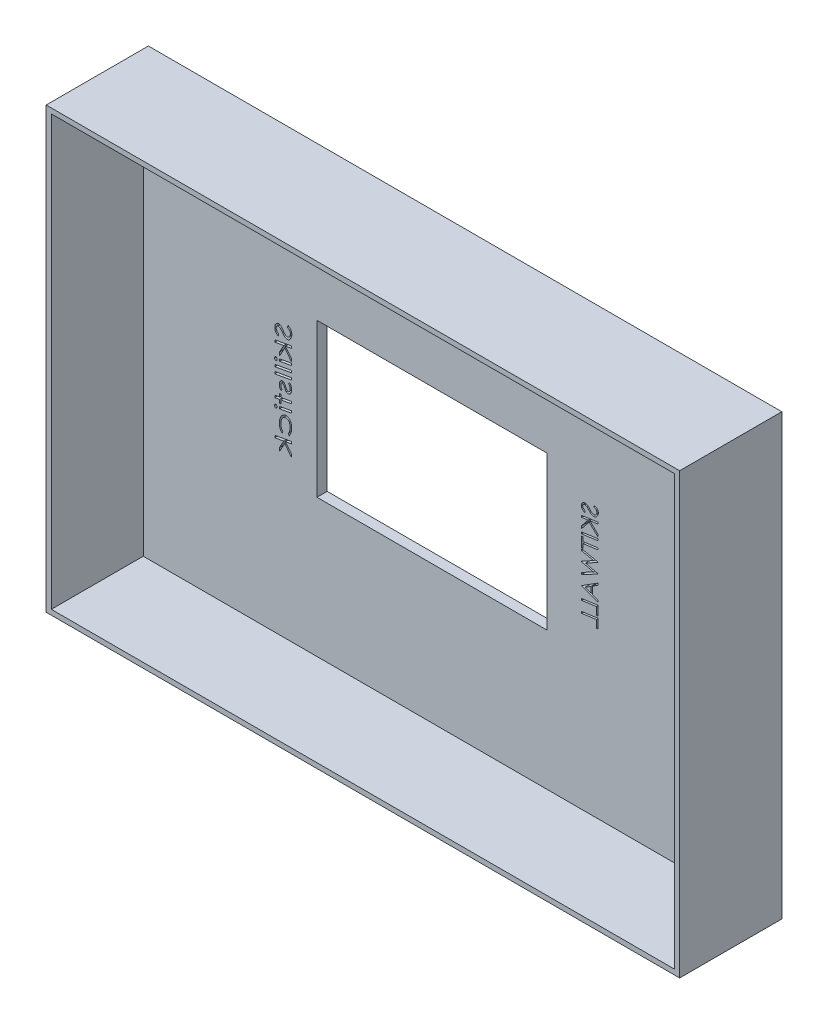
from build123d import *

# Parameters (mm, degrees)
SKETCH1_W           = 124
SKETCH1_H           = 86
BOSS_EXTRUDE1_DEPTH = 20
SKETCH2_W           = 122
SKETCH2_H           = 84
CUT_EXTRUDE1_DEPTH  = 18
SKETCH3_W           = 45
SKETCH3_H           = 30
CUT_EXTRUDE3_DEPTH  = 2


with BuildPart() as part:
    # Sketch1 → Boss-Extrude1 (new body)
    with BuildSketch(Plane.XY):
        with Locations((10.680291971, -5.981021898)):
            Rectangle(SKETCH1_W, SKETCH1_H)
    extrude(amount=BOSS_EXTRUDE1_DEPTH)

    # Sketch2 → Cut-Extrude1 (cut)
    with BuildSketch(Plane.XY.offset(20)):
        with Locations((10.680291971, -5.981021898)):
            Rectangle(SKETCH2_W, SKETCH2_H)
    extrude(amount=-CUT_EXTRUDE1_DEPTH, mode=Mode.SUBTRACT)

    # Sketch3 → Cut-Extrude3 (cut)
    # profile 1 of 21: a face of its own
    with BuildSketch(Plane(origin=(0, 0, 0), x_dir=(-1, 0, 0), z_dir=(0, 0, -1))):
        with Locations((-6.180291971, -5.981021898)):
            Rectangle(SKETCH3_W, SKETCH3_H)
    # profile 2 of 21: a face of its own
    with BuildSketch(Plane(origin=(0, 0, 0), x_dir=(-1, 0, 0), z_dir=(0, 0, -1))):
        with BuildLine():
            Line((23.87777093, 2.582439641), (23.80272085, 2.990762958))
            add(Edge.make_bspline(
                [(23.80272085, 2.990762958), (23.83890379, 3.006202168), (23.910195381, 3.036622191), (24.006391251, 3.10085006), (24.091189179, 3.177917187), (24.161474839, 3.268589162), (24.219582314, 3.366628265), (24.260220965, 3.470914038), (24.286642436, 3.578617158), (24.289660373, 3.652067565), (24.291182388, 3.689110314)],
                knots=[0, 0, 0, 0, 1.040424116, 2.049957518, 3.047859964, 4.063733633, 5.078193139, 6.056602271, 7.019899302, 8, 8, 8, 8], degree=3))
            add(Edge.make_bspline(
                [(24.291182388, 3.689110314), (24.290832534, 3.709476418), (24.29014959, 3.749232613), (24.284354108, 3.807272988), (24.274729855, 3.862527969), (24.26166052, 3.914935872), (24.24441416, 3.964645422), (24.22264099, 4.01083436), (24.197738157, 4.054576539), (24.169266186, 4.095090979), (24.137725802, 4.131942457), (24.103217167, 4.164060328), (24.06577851, 4.191051187), (24.026022358, 4.213491185), (23.982969811, 4.229848963), (23.9382277, 4.242964831), (23.890272724, 4.24977654), (23.857648487, 4.250815793), (23.840881907, 4.251349897)],
                knots=[0, 0, 0, 0, 1.20849648, 2.359077707, 3.457497078, 4.53474134, 5.561418966, 6.574670319, 7.56100237, 8.545406421, 9.50892298, 10.434902817, 11.335926509, 12.242729982, 13.135279908, 14.063394424, 15.004719994, 16, 16, 16, 16], degree=3))
            add(Edge.make_bspline(
                [(23.840881907, 4.251349897), (23.825804849, 4.250819432), (23.795042851, 4.249737116), (23.748644795, 4.242046), (23.702229675, 4.228225819), (23.655017769, 4.210369351), (23.607848787, 4.186620262), (23.55958276, 4.158526917), (23.511318886, 4.124624241), (23.479894743, 4.099113491), (23.463723454, 4.085985314)],
                knots=[0, 0, 0, 0, 0.861041419, 1.756798584, 2.676539428, 3.623222833, 4.635828562, 5.68868022, 6.810563605, 8, 8, 8, 8], degree=3))
            add(Edge.make_bspline(
                [(23.463723454, 4.085985314), (23.452567703, 4.076161356), (23.427905167, 4.054443076), (23.390497232, 4.015323312), (23.349703676, 3.966696847), (23.303480077, 3.90997717), (23.253661104, 3.843683158), (23.198687556, 3.768749667), (23.140702331, 3.684045194), (23.100528107, 3.624679404), (23.079568806, 3.593707669)],
                knots=[0, 0, 0, 0, 0.569759019, 1.259592684, 2.072497206, 3.003039976, 4.064660121, 5.251552732, 6.566107193, 8, 8, 8, 8], degree=3))
            add(Edge.make_bspline(
                [(23.079568806, 3.593707669), (23.057872833, 3.561176634), (23.015842883, 3.498156747), (22.952209793, 3.407755113), (22.888832888, 3.32572634), (22.827174052, 3.250600521), (22.766057888, 3.184127753), (22.70674892, 3.124127389), (22.648086164, 3.072293525), (22.590175331, 3.027817976), (22.533119629, 2.989923578), (22.476351534, 2.957730239), (22.420531293, 2.929048225), (22.364059562, 2.907133429), (22.308397528, 2.888769809), (22.252670519, 2.877123648), (22.197661986, 2.868796346), (22.160978214, 2.867847787), (22.14271484, 2.867375538)],
                knots=[0, 0, 0, 0, 1.520170293, 2.944909634, 4.296714461, 5.549350901, 6.721961554, 7.80597782, 8.82789845, 9.762604862, 10.642697466, 11.488145661, 12.29906103, 13.079627452, 13.840762024, 14.574725496, 15.290413151, 16, 16, 16, 16], degree=3))
            add(Edge.make_bspline(
                [(22.14271484, 2.867375538), (22.123607309, 2.867834149), (22.085212983, 2.868755674), (22.028070705, 2.877219432), (21.971579215, 2.891572414), (21.915614068, 2.910651359), (21.859948757, 2.934853412), (21.805016744, 2.965160411), (21.750571821, 3.000626902), (21.69705398, 3.041504489), (21.645537243, 3.08688703), (21.596035665, 3.136192558), (21.549902242, 3.189487176), (21.506342409, 3.246750827), (21.465099061, 3.307196984), (21.427571223, 3.372061236), (21.392579618, 3.44021417), (21.349256521, 3.53580709), (21.305471574, 3.660926541), (21.265964725, 3.815715706), (21.242687999, 3.975245367), (21.239768263, 4.083155237), (21.238297773, 4.137502742)],
                knots=[0, 0, 0, 0, 0.668982992, 1.344242259, 2.017825385, 2.708226424, 3.413209583, 4.140977225, 4.903055327, 5.68724377, 6.497576667, 7.306206538, 8.132609876, 8.964334176, 9.825248329, 10.69384638, 11.587230732, 12.507851973, 14.368044277, 16.221301885, 18.096904294, 20, 20, 20, 20], degree=3))
            add(Edge.make_bspline(
                [(21.238297773, 4.137502742), (21.238923359, 4.172081633), (21.24015361, 4.24008301), (21.249410869, 4.340096145), (21.26344618, 4.436758298), (21.285784224, 4.529542827), (21.311881696, 4.61954347), (21.345291494, 4.70550136), (21.384150635, 4.788109463), (21.429245228, 4.866799835), (21.480109777, 4.94137235), (21.536720483, 5.010941544), (21.599300047, 5.074580527), (21.667259854, 5.133044226), (21.740998389, 5.185695101), (21.820356851, 5.232637735), (21.90458474, 5.275458392), (21.964184357, 5.298138321), (21.994522733, 5.30968323)],
                knots=[0, 0, 0, 0, 1.110060354, 2.182997449, 3.222707229, 4.243119384, 5.244579262, 6.229336086, 7.200662002, 8.173298863, 9.138091364, 10.095967355, 11.049042419, 12.00000032, 12.970920677, 13.953864319, 14.958442399, 16, 16, 16, 16], degree=3))
            Line((21.994522733, 5.30968323), (22.093105465, 4.909628142))
            add(Edge.make_bspline(
                [(22.093105465, 4.909628142), (22.0696825, 4.901209862), (22.023751873, 4.884702265), (21.957853959, 4.855739906), (21.897485189, 4.821529285), (21.840798613, 4.784864937), (21.789554598, 4.74319129), (21.742005074, 4.69882827), (21.699882166, 4.650020466), (21.662354668, 4.597785196), (21.629551554, 4.542798141), (21.601182647, 4.48532358), (21.577273716, 4.42597285), (21.557272205, 4.364397717), (21.542143232, 4.300989608), (21.531452593, 4.235299414), (21.523983536, 4.167779909), (21.523484759, 4.121834869), (21.52323367, 4.098705666)],
                knots=[0, 0, 0, 0, 1.119667471, 2.195581549, 3.233144551, 4.238377303, 5.228933006, 6.200479696, 7.160535075, 8.124042796, 9.090755306, 10.037692277, 11.004734089, 11.966919088, 12.94778449, 13.934060519, 14.959984955, 16, 16, 16, 16], degree=3))
            add(Edge.make_bspline(
                [(21.52323367, 4.098705666), (21.523648, 4.072392175), (21.524465429, 4.020478338), (21.533156208, 3.94419747), (21.546219999, 3.870530536), (21.565479309, 3.79999177), (21.589576044, 3.731987241), (21.61979626, 3.66708745), (21.654579498, 3.604444806), (21.69511259, 3.545892308), (21.739194534, 3.492125382), (21.786189954, 3.444400348), (21.836794951, 3.405048952), (21.889290492, 3.372111671), (21.944289508, 3.346273233), (22.002138361, 3.328601224), (22.062354985, 3.317367406), (22.1034439, 3.315883888), (22.124270329, 3.315131948)],
                knots=[0, 0, 0, 0, 1.153147951, 2.275043374, 3.361614631, 4.430348707, 5.476988232, 6.520858919, 7.565391488, 8.614710216, 9.638187901, 10.610899785, 11.544316246, 12.441873011, 13.323454024, 14.199530016, 15.087409336, 16, 16, 16, 16], degree=3))
            add(Edge.make_bspline(
                [(22.124270329, 3.315131948), (22.155391772, 3.316727271), (22.218188853, 3.319946324), (22.310912549, 3.346505322), (22.402235578, 3.38770376), (22.476305621, 3.435724953), (22.535985825, 3.483869686), (22.583843748, 3.528689674), (22.633125947, 3.581908716), (22.685492862, 3.642268794), (22.739250152, 3.711087539), (22.795094188, 3.787693376), (22.85391317, 3.871551097), (22.892357771, 3.931085659), (22.91229617, 3.961961876)],
                knots=[0, 0, 0, 0, 1.051433832, 2.12159104, 3.238864972, 4.432727037, 5.095930102, 5.831841146, 6.648864512, 7.549068141, 8.534936099, 9.602373226, 10.75652658, 12, 12, 12, 12], degree=3))
            add(Edge.make_bspline(
                [(22.91229617, 3.961961876), (22.933792426, 3.994697069), (22.975205409, 4.0577621), (23.036688897, 4.146889233), (23.093889806, 4.227449901), (23.147411531, 4.298470976), (23.196094788, 4.361430947), (23.241981826, 4.414472767), (23.282927334, 4.459696693), (23.31048801, 4.485147509), (23.323163558, 4.496852702)],
                knots=[0, 0, 0, 0, 1.390361992, 2.678561301, 3.844059859, 4.897843402, 5.835947529, 6.668696462, 7.387714544, 8, 8, 8, 8], degree=3))
            add(Edge.make_bspline(
                [(23.323163558, 4.496852702), (23.342792011, 4.513155101), (23.38125299, 4.545098842), (23.442852724, 4.585237706), (23.504007764, 4.620945363), (23.566338363, 4.649712814), (23.629978007, 4.671336834), (23.693980887, 4.687274804), (23.758944342, 4.697312299), (23.802473425, 4.698506339), (23.824345449, 4.699106307)],
                knots=[0, 0, 0, 0, 1.108252639, 2.171565986, 3.191208793, 4.185035804, 5.149720618, 6.108621288, 7.049640459, 8, 8, 8, 8], degree=3))
            add(Edge.make_bspline(
                [(23.824345449, 4.699106307), (23.850910506, 4.698325216), (23.903362501, 4.696782971), (23.980328055, 4.682247736), (24.05367751, 4.658846939), (24.123153255, 4.625749026), (24.189491087, 4.5841454), (24.25163204, 4.532151308), (24.310425913, 4.471353239), (24.36460564, 4.401935845), (24.414561064, 4.326428763), (24.457954392, 4.24528984), (24.494189385, 4.159599169), (24.524054089, 4.069619821), (24.547875388, 3.975075216), (24.563836054, 3.875890303), (24.574582456, 3.772452905), (24.575599919, 3.702071117), (24.576118286, 3.666213679)],
                knots=[0, 0, 0, 0, 0.897458888, 1.772008542, 2.637996419, 3.494167451, 4.367246927, 5.278654213, 6.226651578, 7.221929489, 8.251817514, 9.284495894, 10.328359557, 11.393783616, 12.487364289, 13.621066129, 14.788003582, 16, 16, 16, 16], degree=3))
            add(Edge.make_bspline(
                [(24.576118286, 3.666213679), (24.575693816, 3.635665595), (24.574857985, 3.575512862), (24.566296457, 3.48647785), (24.5523459, 3.400254003), (24.533248384, 3.316264944), (24.508491305, 3.234814455), (24.477912621, 3.156027387), (24.442035905, 3.079705058), (24.40088253, 3.006338966), (24.354797996, 2.936060828), (24.302113252, 2.871168952), (24.244929871, 2.810286537), (24.181682065, 2.754992316), (24.11324467, 2.704588213), (24.039811479, 2.658849561), (23.961467815, 2.616891586), (23.905974749, 2.59404911), (23.87777093, 2.582439641)],
                knots=[0, 0, 0, 0, 1.064997916, 2.097104855, 3.115618573, 4.109168452, 5.098418183, 6.081432649, 7.053741348, 8.036783613, 9.01279529, 9.980342368, 10.947804708, 11.922163005, 12.905455433, 13.908531521, 14.937031167, 16, 16, 16, 16], degree=3))
        make_face()
    # profile 3 of 21: a face of its own
    with BuildSketch(Plane(origin=(0, 0, 0), x_dir=(-1, 0, 0), z_dir=(0, 0, -1))):
        Polygon((24.576118286, 1.594704264), (24.576118286, 1.184472894), (22.812441403, 1.498665602), (23.639900337, -0.016328388), (23.639900337, -0.69432318), (22.622272132, 1.168572453), (21.319708029, -0.490797539), (21.319708029, 0.065081868), (22.489980465, 1.556543206), (21.319708029, 1.765156988), (21.319708029, 2.175388359), align=None)
    # profile 4 of 21: a face of its own
    with BuildSketch(Plane(origin=(0, 0, 0), x_dir=(-1, 0, 0), z_dir=(0, 0, -1))):
        with BuildLine():
            add(Edge.make_bspline(
                [(24.616823414, -1.48807318), (24.616003711, -1.509554142), (24.614404182, -1.55147109), (24.600836578, -1.612211863), (24.57763868, -1.667936944), (24.5468001, -1.717818573), (24.510099386, -1.759979685), (24.467727162, -1.790713441), (24.421547674, -1.810788433), (24.3888994, -1.812739641), (24.372592645, -1.813714206)],
                knots=[0, 0, 0, 0, 1.146181918, 2.236605911, 3.302541568, 4.354984973, 5.357213, 6.265309807, 7.133578477, 8, 8, 8, 8], degree=3))
            add(Edge.make_bspline(
                [(24.372592645, -1.813714206), (24.356080667, -1.812733143), (24.32303612, -1.810769794), (24.276325061, -1.790895224), (24.233797939, -1.759968782), (24.197213131, -1.717783329), (24.165955857, -1.668232947), (24.144715888, -1.611894861), (24.130673268, -1.551514447), (24.129145039, -1.509568833), (24.128361875, -1.48807318)],
                knots=[0, 0, 0, 0, 0.876210172, 1.753513102, 2.660104476, 3.660671021, 4.711369698, 5.767101909, 6.855718209, 8, 8, 8, 8], degree=3))
            add(Edge.make_bspline(
                [(24.128361875, -1.48807318), (24.129135502, -1.466153996), (24.130638212, -1.423577692), (24.144627673, -1.362539361), (24.165823684, -1.30614242), (24.197199396, -1.257009792), (24.234027247, -1.215584615), (24.27615917, -1.184433183), (24.323190915, -1.165555292), (24.356106166, -1.163474416), (24.372592645, -1.162432154)],
                knots=[0, 0, 0, 0, 1.165167418, 2.263246766, 3.317471476, 4.357095716, 5.347847758, 6.253144593, 7.125040986, 8, 8, 8, 8], degree=3))
            add(Edge.make_bspline(
                [(24.372592645, -1.162432154), (24.388873773, -1.163467423), (24.421391493, -1.165535129), (24.467895499, -1.184613763), (24.509869368, -1.215574779), (24.546812661, -1.256974767), (24.577775868, -1.306436438), (24.600929966, -1.362220334), (24.61443633, -1.42362223), (24.616012149, -1.466169132), (24.616823414, -1.48807318)],
                knots=[0, 0, 0, 0, 0.865187755, 1.728008775, 2.634812469, 3.627213609, 4.668568295, 5.732986079, 6.832893171, 8, 8, 8, 8], degree=3))
        make_face()
    # profile 5 of 21: a face of its own
    with BuildSketch(Plane(origin=(0, 0, 0), x_dir=(-1, 0, 0), z_dir=(0, 0, -1))):
        Polygon((23.639900337, -1.174516489), (23.639900337, -1.584747859), (21.319708029, -1.165612242), (21.319708029, -0.755380872), align=None)
    # profile 6 of 21: a face of its own
    with BuildSketch(Plane(origin=(0, 0, 0), x_dir=(-1, 0, 0), z_dir=(0, 0, -1))):
        Polygon((24.576118286, -2.557218813), (24.576118286, -2.967450183), (21.319708029, -2.386766089), (21.319708029, -1.976534718), align=None)
    # profile 7 of 21: a face of its own
    with BuildSketch(Plane(origin=(0, 0, 0), x_dir=(-1, 0, 0), z_dir=(0, 0, -1))):
        Polygon((24.576118286, -3.778372659), (24.576118286, -4.188604029), (21.319708029, -3.607919935), (21.319708029, -3.197688564), align=None)
    # profile 8 of 21: a face of its own
    with BuildSketch(Plane(origin=(0, 0, 0), x_dir=(-1, 0, 0), z_dir=(0, 0, -1))):
        with BuildLine():
            Line((23.358144528, -6.382864847), (23.114549776, -6.158986641))
            add(Edge.make_bspline(
                [(23.114549776, -6.158986641), (23.137150742, -6.136152968), (23.181580564, -6.091265681), (23.237756857, -6.016612727), (23.286873051, -5.939933434), (23.327027975, -5.859890315), (23.357841162, -5.776443434), (23.379305996, -5.689825141), (23.393197149, -5.600162626), (23.394840452, -5.539132741), (23.395669568, -5.508340608)],
                knots=[0, 0, 0, 0, 1.056735957, 2.077370957, 3.068920944, 4.052303794, 5.01967449, 5.991493006, 6.986624112, 8, 8, 8, 8], degree=3))
            add(Edge.make_bspline(
                [(23.395669568, -5.508340608), (23.394422413, -5.473706582), (23.392009938, -5.406711073), (23.374150661, -5.309993933), (23.343501858, -5.221156678), (23.301345977, -5.142523548), (23.253359978, -5.075823252), (23.200202765, -5.02680796), (23.143395579, -4.994435586), (23.103044993, -4.990588585), (23.083384912, -4.988714206)],
                knots=[0, 0, 0, 0, 1.260238561, 2.437785407, 3.565315121, 4.666579534, 5.675975842, 6.539247482, 7.288275219, 8, 8, 8, 8], degree=3))
            add(Edge.make_bspline(
                [(23.083384912, -4.988714206), (23.068168917, -4.989837909), (23.037199796, -4.992124983), (22.991954624, -5.010942219), (22.948418925, -5.040746137), (22.9226698, -5.067076889), (22.909116082, -5.080936762)],
                knots=[0, 0, 0, 0, 0.897401691, 1.826482028, 2.85591256, 4, 4, 4, 4], degree=3))
            add(Edge.make_bspline(
                [(22.909116082, -5.080936762), (22.901737231, -5.089497864), (22.885596666, -5.108224496), (22.86303697, -5.14218358), (22.837579258, -5.182436537), (22.8110311, -5.230626493), (22.782416896, -5.285671457), (22.752930098, -5.348418059), (22.719991, -5.41753835), (22.698846562, -5.46670952), (22.687781947, -5.492440167)],
                knots=[0, 0, 0, 0, 0.578152617, 1.264656223, 2.083871077, 3.016922674, 4.080117085, 5.259875081, 6.566127475, 8, 8, 8, 8], degree=3))
            add(Edge.make_bspline(
                [(22.687781947, -5.492440167), (22.67113519, -5.529797085), (22.639125715, -5.601629412), (22.591484249, -5.704201832), (22.543241465, -5.795784508), (22.49790481, -5.878046969), (22.453546026, -5.95017823), (22.410076054, -6.012039307), (22.369012863, -6.064888398), (22.339126927, -6.093968369), (22.325251899, -6.107469214)],
                knots=[0, 0, 0, 0, 1.367098484, 2.628746476, 3.779308568, 4.826211092, 5.768176828, 6.607645287, 7.353576879, 8, 8, 8, 8], degree=3))
            add(Edge.make_bspline(
                [(22.325251899, -6.107469214), (22.311697957, -6.119002551), (22.285100688, -6.14163473), (22.241818834, -6.170082547), (22.197891415, -6.195282949), (22.151984294, -6.215934639), (22.104169071, -6.230611462), (22.055461868, -6.24276281), (22.004848078, -6.248789555), (21.97057801, -6.249972622), (21.953181587, -6.25057318)],
                knots=[0, 0, 0, 0, 1.046391566, 2.053362479, 3.042238884, 4.025273708, 5.007754151, 5.982200575, 6.975709849, 8, 8, 8, 8], degree=3))
            add(Edge.make_bspline(
                [(21.953181587, -6.25057318), (21.929368537, -6.24976034), (21.882416661, -6.248157673), (21.813834536, -6.234144367), (21.748134617, -6.212464213), (21.685497031, -6.181872172), (21.626440912, -6.141569543), (21.570433677, -6.093216644), (21.517991802, -6.035676364), (21.468821527, -5.970535182), (21.423709402, -5.898373093), (21.385104164, -5.820041457), (21.352678574, -5.736474072), (21.325060812, -5.647994504), (21.304361998, -5.553915227), (21.289912424, -5.454641425), (21.280864616, -5.350351529), (21.279632592, -5.27896905), (21.279002901, -5.242485239)],
                knots=[0, 0, 0, 0, 0.848100906, 1.672189404, 2.484761384, 3.309473431, 4.147922466, 5.026684471, 5.941276925, 6.917727177, 7.932724924, 8.970345566, 10.025731657, 11.125353491, 12.271343272, 13.455595066, 14.699546597, 16, 16, 16, 16], degree=3))
            add(Edge.make_bspline(
                [(21.279002901, -5.242485239), (21.279939775, -5.194080804), (21.281783691, -5.098813267), (21.301205215, -4.95904863), (21.330511185, -4.824942347), (21.373032251, -4.696789541), (21.42693339, -4.574281618), (21.493693301, -4.458263127), (21.571490299, -4.347389356), (21.632314658, -4.280011607), (21.663157548, -4.245845616)],
                knots=[0, 0, 0, 0, 1.059877863, 2.086006233, 3.085581695, 4.063852453, 5.039174428, 6.012846943, 6.992352002, 8, 8, 8, 8], degree=3))
            Line((21.663157548, -4.245845616), (21.879403542, -4.495800544))
            add(Edge.make_bspline(
                [(21.879403542, -4.495800544), (21.854325886, -4.525952149), (21.805059863, -4.585186139), (21.740691794, -4.678974038), (21.686396059, -4.774806758), (21.641400309, -4.87230454), (21.607050516, -4.972100805), (21.581906015, -5.073775029), (21.567053975, -5.177596276), (21.564978406, -5.247527394), (21.563938798, -5.28255435)],
                knots=[0, 0, 0, 0, 1.085690787, 2.132881387, 3.145171119, 4.133055604, 5.102321853, 6.063552262, 7.030075988, 8, 8, 8, 8], degree=3))
            add(Edge.make_bspline(
                [(21.563938798, -5.28255435), (21.565440324, -5.321661927), (21.568369577, -5.397954985), (21.590219487, -5.508686715), (21.627399857, -5.611610296), (21.670430455, -5.689932052), (21.710034661, -5.746604705), (21.742216706, -5.78261409), (21.774185192, -5.814480347), (21.808488695, -5.839136433), (21.843047541, -5.859771015), (21.879547208, -5.873259864), (21.916831112, -5.883157958), (21.942303666, -5.883869744), (21.95508964, -5.884227026)],
                knots=[0, 0, 0, 0, 1.791420007, 3.494793534, 5.148228932, 6.787359524, 7.574541836, 8.311179832, 8.998295426, 9.637591313, 10.242522343, 10.836112863, 11.415785714, 12, 12, 12, 12], degree=3))
            add(Edge.make_bspline(
                [(21.95508964, -5.884227026), (21.976125862, -5.882614467), (22.019488949, -5.879290413), (22.082004755, -5.851350088), (22.143346833, -5.80915822), (22.178629078, -5.770985441), (22.197412356, -5.750663324)],
                knots=[0, 0, 0, 0, 0.882321082, 1.818775499, 2.83877726, 4, 4, 4, 4], degree=3))
            add(Edge.make_bspline(
                [(22.197412356, -5.750663324), (22.204122382, -5.742068954), (22.219523167, -5.722343242), (22.241934599, -5.686287169), (22.267876225, -5.641361223), (22.296493552, -5.587035843), (22.327416069, -5.52350438), (22.361121079, -5.45067474), (22.39801412, -5.368623917), (22.423264407, -5.31056814), (22.436554984, -5.280010279)],
                knots=[0, 0, 0, 0, 0.494333513, 1.134589315, 1.9230915, 2.848054825, 3.919036404, 5.128104878, 6.488368003, 8, 8, 8, 8], degree=3))
            add(Edge.make_bspline(
                [(22.436554984, -5.280010279), (22.451252084, -5.246872596), (22.479367575, -5.183480346), (22.522005705, -5.093459738), (22.563300967, -5.012615458), (22.602990982, -4.940659027), (22.641976568, -4.878263459), (22.678505703, -4.824544543), (22.713922427, -4.779936937), (22.73906798, -4.755293778), (22.750747693, -4.743847419)],
                knots=[0, 0, 0, 0, 1.392116303, 2.663112666, 3.824672077, 4.878011466, 5.817843301, 6.64893779, 7.372452911, 8, 8, 8, 8], degree=3))
            add(Edge.make_bspline(
                [(22.750747693, -4.743847419), (22.772741456, -4.725023782), (22.81563257, -4.688314886), (22.890384222, -4.651321561), (22.968375007, -4.626424794), (23.022343378, -4.623731889), (23.049675978, -4.622368052)],
                knots=[0, 0, 0, 0, 1.048162553, 2.044073104, 3.009409298, 4, 4, 4, 4], degree=3))
            add(Edge.make_bspline(
                [(23.049675978, -4.622368052), (23.07113325, -4.623338895), (23.113747383, -4.625266991), (23.176487888, -4.637194106), (23.236216192, -4.659017323), (23.294131548, -4.687488439), (23.34897489, -4.725643624), (23.401121547, -4.771822916), (23.451257174, -4.825715233), (23.497604498, -4.88784786), (23.540463592, -4.955843921), (23.578430883, -5.02891362), (23.609863763, -5.106541519), (23.636373437, -5.188268426), (23.655532754, -5.274613835), (23.670566328, -5.365002646), (23.678497603, -5.460074663), (23.679892932, -5.524864599), (23.680605465, -5.557949983)],
                knots=[0, 0, 0, 0, 0.825847966, 1.640133692, 2.445091386, 3.265888247, 4.11662018, 5.006758676, 5.94181087, 6.943513563, 7.984564672, 9.031638348, 10.107144818, 11.203514844, 12.333389821, 13.506800131, 14.726831965, 16, 16, 16, 16], degree=3))
            add(Edge.make_bspline(
                [(23.680605465, -5.557949983), (23.6798012, -5.596999892), (23.678231415, -5.673218517), (23.664484228, -5.784728595), (23.642431665, -5.890564519), (23.61109653, -5.991991883), (23.56810803, -6.090885083), (23.511706044, -6.188882544), (23.441041761, -6.287255988), (23.386446459, -6.350223041), (23.358144528, -6.382864847)],
                knots=[0, 0, 0, 0, 1.030436802, 2.011233252, 2.960618385, 3.881010992, 4.808352614, 5.800940215, 6.860018412, 8, 8, 8, 8], degree=3))
        make_face()
    # profile 9 of 21: a face of its own
    with BuildSketch(Plane(origin=(0, 0, 0), x_dir=(-1, 0, 0), z_dir=(0, 0, -1))):
        Polygon((24.576118286, -7.80309221), (24.576118286, -8.213323581), (23.639900337, -8.047958997), (23.639900337, -8.733586), (23.354964439, -8.686520696), (23.354964439, -7.997713605), (21.319708029, -7.637727627), (21.319708029, -7.227496257), (23.354964439, -7.587482234), (23.354964439, -7.023970616), (23.639900337, -7.073579991), (23.639900337, -7.637727627), align=None)
    # profile 10 of 21: a face of its own
    with BuildSketch(Plane(origin=(0, 0, 0), x_dir=(-1, 0, 0), z_dir=(0, 0, -1))):
        with BuildLine():
            add(Edge.make_bspline(
                [(24.616823414, -9.547688564), (24.616003711, -9.569169527), (24.614404182, -9.611086474), (24.600836578, -9.671827248), (24.57763868, -9.727552329), (24.5468001, -9.777433958), (24.510099386, -9.819595069), (24.467727162, -9.850328826), (24.421547674, -9.870403818), (24.3888994, -9.872355025), (24.372592645, -9.87332959)],
                knots=[0, 0, 0, 0, 1.146181918, 2.236605911, 3.302541568, 4.354984973, 5.357213, 6.265309807, 7.133578477, 8, 8, 8, 8], degree=3))
            add(Edge.make_bspline(
                [(24.372592645, -9.87332959), (24.356080667, -9.872348527), (24.32303612, -9.870385179), (24.276325061, -9.850510608), (24.233797939, -9.819584166), (24.197213131, -9.777398714), (24.165955857, -9.727848332), (24.144715888, -9.671510245), (24.130673268, -9.611129832), (24.129145039, -9.569184217), (24.128361875, -9.547688564)],
                knots=[0, 0, 0, 0, 0.876210172, 1.753513102, 2.660104476, 3.660671021, 4.711369698, 5.767101909, 6.855718209, 8, 8, 8, 8], degree=3))
            add(Edge.make_bspline(
                [(24.128361875, -9.547688564), (24.129135502, -9.525769381), (24.130638212, -9.483193077), (24.144627673, -9.422154745), (24.165823684, -9.365757805), (24.197199396, -9.316625176), (24.234027247, -9.2752), (24.27615917, -9.244048567), (24.323190915, -9.225170677), (24.356106166, -9.223089801), (24.372592645, -9.222047539)],
                knots=[0, 0, 0, 0, 1.165167418, 2.263246766, 3.317471476, 4.357095716, 5.347847758, 6.253144593, 7.125040986, 8, 8, 8, 8], degree=3))
            add(Edge.make_bspline(
                [(24.372592645, -9.222047539), (24.388873773, -9.223082808), (24.421391493, -9.225150513), (24.467895499, -9.244229148), (24.509869368, -9.275190164), (24.546812661, -9.316590152), (24.577775868, -9.366051823), (24.600929966, -9.421835719), (24.61443633, -9.483237614), (24.616012149, -9.525784517), (24.616823414, -9.547688564)],
                knots=[0, 0, 0, 0, 0.865187755, 1.728008775, 2.634812469, 3.627213609, 4.668568295, 5.732986079, 6.832893171, 8, 8, 8, 8], degree=3))
        make_face()
    # profile 11 of 21: a face of its own
    with BuildSketch(Plane(origin=(0, 0, 0), x_dir=(-1, 0, 0), z_dir=(0, 0, -1))):
        Polygon((23.639900337, -9.234131874), (23.639900337, -9.644363244), (21.319708029, -9.225227627), (21.319708029, -8.814996257), align=None)
    # profile 12 of 21: a face of its own
    with BuildSketch(Plane(origin=(0, 0, 0), x_dir=(-1, 0, 0), z_dir=(0, 0, -1))):
        with BuildLine():
            Line((23.13235827, -13.496086), (22.988618286, -13.157724622))
            add(Edge.make_bspline(
                [(22.988618286, -13.157724622), (23.021328509, -13.127199149), (23.086890456, -13.066016153), (23.169318445, -12.958164392), (23.240014011, -12.839607252), (23.297097573, -12.708921493), (23.341584086, -12.566864905), (23.373023172, -12.413236449), (23.392304474, -12.248075418), (23.394525234, -12.134002957), (23.395669568, -12.075222619)],
                knots=[0, 0, 0, 0, 0.898412299, 1.800710984, 2.718351025, 3.668983686, 4.661414346, 5.706620306, 6.81824559, 8, 8, 8, 8], degree=3))
            add(Edge.make_bspline(
                [(23.395669568, -12.075222619), (23.395374823, -12.040442178), (23.394792011, -11.971669077), (23.387974822, -11.869633341), (23.378139419, -11.769850896), (23.363522206, -11.672408569), (23.344221579, -11.57741322), (23.321444677, -11.484644742), (23.294726746, -11.393940028), (23.2637879, -11.306024895), (23.228813068, -11.221599377), (23.190873511, -11.141414297), (23.149318878, -11.066096603), (23.104958922, -10.995421733), (23.057061083, -10.929434456), (23.005591257, -10.86866152), (22.951250896, -10.812066138), (22.893726596, -10.760955957), (22.83392378, -10.715139146), (22.773010267, -10.675010088), (22.711025869, -10.640880772), (22.647672199, -10.613550446), (22.58350418, -10.59172727), (22.518133399, -10.576349376), (22.451861463, -10.567322109), (22.407324977, -10.5659856), (22.385037556, -10.56531677)],
                knots=[0, 0, 0, 0, 1.247975469, 2.467684142, 3.668379478, 4.845534018, 6.00192565, 7.146012619, 8.272662724, 9.394008252, 10.489026953, 11.550818915, 12.575800118, 13.574232674, 14.543631125, 15.499287504, 16.430150882, 17.357057033, 18.257930005, 19.131564186, 19.972551822, 20.793758577, 21.604572809, 22.40181582, 23.200219724, 24, 24, 24, 24], degree=3))
            add(Edge.make_bspline(
                [(22.385037556, -10.56531677), (22.365307345, -10.56590675), (22.326383623, -10.567070661), (22.268659098, -10.573290381), (22.212719901, -10.58481587), (22.158170901, -10.601066365), (22.104810228, -10.620836157), (22.053866275, -10.647059127), (22.003719997, -10.676138843), (21.939488457, -10.722133692), (21.864662662, -10.789745305), (21.785313673, -10.88493367), (21.718848556, -10.995915261), (21.662140353, -11.12015778), (21.618059234, -11.257913031), (21.586555816, -11.407713306), (21.567301442, -11.569087228), (21.565082757, -11.680624455), (21.563938798, -11.738133276)],
                knots=[0, 0, 0, 0, 0.592401021, 1.168687514, 1.740316786, 2.304170367, 2.876224589, 3.445439815, 4.021726308, 4.615049568, 5.813717365, 7.038406775, 8.320863332, 9.684992103, 11.130003001, 12.652800016, 14.274176889, 16, 16, 16, 16], degree=3))
            add(Edge.make_bspline(
                [(21.563938798, -11.738133276), (21.565164409, -11.798388907), (21.567595956, -11.917932864), (21.586944459, -12.095139158), (21.619884013, -12.267988911), (21.656256167, -12.408465757), (21.692362634, -12.51615419), (21.719879528, -12.592883178), (21.75061866, -12.66436699), (21.782345364, -12.731906266), (21.816627024, -12.794372046), (21.852090168, -12.852603763), (21.889858843, -12.905839516), (21.916943401, -12.938665356), (21.930284952, -12.954834999)],
                knots=[0, 0, 0, 0, 1.676064664, 3.325222843, 4.951633217, 6.568207303, 7.357149075, 8.110983963, 8.835091753, 9.521009449, 10.186122861, 10.816324272, 11.416934534, 12, 12, 12, 12], degree=3))
            Line((21.930284952, -12.954834999), (21.75665214, -13.292560359))
            add(Edge.make_bspline(
                [(21.75665214, -13.292560359), (21.717072521, -13.239607147), (21.638659484, -13.134699056), (21.53924064, -12.966326082), (21.457070415, -12.791077602), (21.401216604, -12.639630446), (21.365942942, -12.513931652), (21.342338719, -12.416179578), (21.32257984, -12.314744562), (21.306946561, -12.20965457), (21.294049843, -12.100872616), (21.285267063, -11.988209621), (21.280237636, -11.871955509), (21.279418048, -11.79325965), (21.279002901, -11.753397699)],
                knots=[0, 0, 0, 0, 1.446394239, 2.865519398, 4.27101083, 5.678982598, 6.392959336, 7.127998255, 7.879797262, 8.654287382, 9.45329277, 10.277299635, 11.127397569, 12, 12, 12, 12], degree=3))
            add(Edge.make_bspline(
                [(21.279002901, -11.753397699), (21.279738475, -11.69230916), (21.281168276, -11.573565927), (21.295641111, -11.400724099), (21.317940991, -11.238100201), (21.350303682, -11.085902418), (21.391580391, -10.944024978), (21.441635653, -10.812274206), (21.501522728, -10.690770443), (21.57059025, -10.580165956), (21.647637582, -10.481538831), (21.730386435, -10.394721409), (21.820025355, -10.321470687), (21.916339215, -10.261848637), (22.018639632, -10.215008247), (22.127253303, -10.181861747), (22.241810118, -10.161611896), (22.320291795, -10.159394148), (22.360232869, -10.158265488)],
                knots=[0, 0, 0, 0, 1.35775446, 2.639188254, 3.852929301, 5.004704381, 6.094923826, 7.134753983, 8.133828109, 9.101516108, 10.028271518, 10.911572417, 11.762480523, 12.594287504, 13.423151825, 14.256506206, 15.112697163, 16, 16, 16, 16], degree=3))
            add(Edge.make_bspline(
                [(22.360232869, -10.158265488), (22.405098472, -10.159961128), (22.493695636, -10.163309551), (22.623794433, -10.190561514), (22.748857747, -10.234135978), (22.869324071, -10.294913574), (22.984045753, -10.374494039), (23.093376594, -10.47124633), (23.19832022, -10.584715451), (23.296130549, -10.714484005), (23.386532861, -10.856018761), (23.464716374, -11.0076893), (23.531752917, -11.166431349), (23.586791417, -11.333103251), (23.628263277, -11.508134821), (23.65893617, -11.690600754), (23.676773301, -11.881094468), (23.679311656, -12.010523928), (23.680605465, -12.076494654)],
                knots=[0, 0, 0, 0, 0.837138057, 1.653116277, 2.470667895, 3.30454217, 4.164334752, 5.070409923, 6.025656531, 7.045461719, 8.100859398, 9.157918887, 10.227711297, 11.315596626, 12.431325069, 13.583274009, 14.76818486, 16, 16, 16, 16], degree=3))
            add(Edge.make_bspline(
                [(23.680605465, -12.076494654), (23.680006873, -12.116145703), (23.67882495, -12.19443698), (23.672761936, -12.310130055), (23.661097857, -12.422353599), (23.645376451, -12.53103641), (23.624987671, -12.63609103), (23.600378605, -12.737687607), (23.570190114, -12.835341543), (23.536901453, -12.929636183), (23.498684909, -13.018858393), (23.457450333, -13.103367802), (23.412033808, -13.182146871), (23.364098024, -13.256524501), (23.311019448, -13.324176733), (23.255475763, -13.387144158), (23.196330672, -13.444817553), (23.153634498, -13.47903491), (23.13235827, -13.496086)],
                knots=[0, 0, 0, 0, 1.208956993, 2.3870942, 3.530609768, 4.647623322, 5.733977532, 6.792142828, 7.832851792, 8.848942891, 9.839382972, 10.790401182, 11.713962802, 12.610322121, 13.485599887, 14.332618586, 15.16911552, 16, 16, 16, 16], degree=3))
        make_face()
    # profile 13 of 21: a face of its own
    with BuildSketch(Plane(origin=(0, 0, 0), x_dir=(-1, 0, 0), z_dir=(0, 0, -1))):
        Polygon((24.576118286, -14.605936762), (24.576118286, -15.016168132), (22.812441403, -14.701975423), (23.639900337, -16.216969414), (23.639900337, -16.894964206), (22.622272132, -15.032068572), (21.319708029, -16.691438564), (21.319708029, -16.135559157), (22.489980465, -14.644097819), (21.319708029, -14.435484037), (21.319708029, -14.025252667), align=None)
    # profile 14 of 21: a face of its own
    with BuildSketch(Plane(origin=(0, 0, 0), x_dir=(-1, 0, 0), z_dir=(0, 0, -1))):
        with BuildLine():
            Line((-36.12222907, 2.663849897), (-36.19727915, 2.986946852))
            add(Edge.make_bspline(
                [(-36.19727915, 2.986946852), (-36.161279731, 2.998699239), (-36.091255252, 3.021559463), (-35.995051587, 3.071134343), (-35.910636468, 3.131204016), (-35.839598626, 3.201442104), (-35.781248273, 3.277433398), (-35.740183081, 3.358863587), (-35.713475797, 3.443006272), (-35.710369961, 3.50065573), (-35.708817612, 3.529469889)],
                knots=[0, 0, 0, 0, 1.160946134, 2.25822112, 3.30751298, 4.329135099, 5.314417989, 6.234116462, 7.117382004, 8, 8, 8, 8], degree=3))
            add(Edge.make_bspline(
                [(-35.708817612, 3.529469889), (-35.710210913, 3.56034706), (-35.712914445, 3.620260462), (-35.735905424, 3.705733153), (-35.776094455, 3.781277461), (-35.829624043, 3.847038686), (-35.896042158, 3.901425519), (-35.97515116, 3.93890869), (-36.063836305, 3.962605298), (-36.12652071, 3.965110983), (-36.159118093, 3.966414)],
                knots=[0, 0, 0, 0, 1.048889288, 2.035242358, 2.980071187, 3.938227355, 4.901981051, 5.872452005, 6.893624386, 8, 8, 8, 8], degree=3))
            add(Edge.make_bspline(
                [(-36.159118093, 3.966414), (-36.189797453, 3.964712279), (-36.25248841, 3.96123494), (-36.346938727, 3.935317844), (-36.442869141, 3.893594951), (-36.50429824, 3.855319513), (-36.536276546, 3.835394368)],
                knots=[0, 0, 0, 0, 0.908721436, 1.856903673, 2.884362775, 4, 4, 4, 4], degree=3))
            add(Edge.make_bspline(
                [(-36.536276546, 3.835394368), (-36.547378387, 3.827442204), (-36.571590971, 3.810098916), (-36.609248552, 3.779413454), (-36.650529355, 3.74084383), (-36.695877242, 3.6949997), (-36.746510256, 3.642770948), (-36.800892937, 3.583067322), (-36.859416586, 3.516092238), (-36.899502917, 3.468887948), (-36.920431194, 3.444243527)],
                knots=[0, 0, 0, 0, 0.596258902, 1.300412146, 2.11936269, 3.062039876, 4.116188298, 5.295698005, 6.588137677, 8, 8, 8, 8], degree=3))
            add(Edge.make_bspline(
                [(-36.920431194, 3.444243527), (-36.942138569, 3.418270329), (-36.984259203, 3.367872362), (-37.048033447, 3.295914465), (-37.111499993, 3.231018282), (-37.173070368, 3.171167032), (-37.234354056, 3.118785661), (-37.293597637, 3.070881788), (-37.35241698, 3.029933074), (-37.427786748, 2.983596977), (-37.52169657, 2.938317748), (-37.634135361, 2.897109206), (-37.746214696, 2.872744033), (-37.820712448, 2.869143249), (-37.85728516, 2.867375538)],
                knots=[0, 0, 0, 0, 1.071062707, 2.078272438, 3.041287067, 3.942732099, 4.794036325, 5.591293899, 6.352427995, 7.059973595, 8.389022164, 9.643020464, 10.842902897, 12, 12, 12, 12], degree=3))
            add(Edge.make_bspline(
                [(-37.85728516, 2.867375538), (-37.895605274, 2.868839335), (-37.972297237, 2.871768906), (-38.08548908, 2.899707656), (-38.196594733, 2.942547608), (-38.303848934, 3.002291751), (-38.404363305, 3.076157201), (-38.495050615, 3.162943124), (-38.574189747, 3.261584958), (-38.64155326, 3.370637466), (-38.694261179, 3.487861357), (-38.733802851, 3.609464256), (-38.757310736, 3.735055798), (-38.760233341, 3.82003368), (-38.761702227, 3.862743126)],
                knots=[0, 0, 0, 0, 0.926789013, 1.854829254, 2.80756285, 3.805163208, 4.818943554, 5.821422699, 6.836788682, 7.874353328, 8.917760384, 9.94255007, 10.965936242, 12, 12, 12, 12], degree=3))
            add(Edge.make_bspline(
                [(-38.761702227, 3.862743126), (-38.761067742, 3.889694847), (-38.759815265, 3.94289762), (-38.750604302, 4.021127219), (-38.736369385, 4.097073207), (-38.71423535, 4.169746115), (-38.687974327, 4.240344254), (-38.654122037, 4.307390181), (-38.615726699, 4.372522024), (-38.570154011, 4.434146216), (-38.519489804, 4.492798676), (-38.462597244, 4.547078864), (-38.399843396, 4.596513906), (-38.332214383, 4.642886149), (-38.258310872, 4.683834209), (-38.179242277, 4.720754065), (-38.094666618, 4.753515821), (-38.035711085, 4.771363728), (-38.005477267, 4.780516564)],
                knots=[0, 0, 0, 0, 1.004869357, 1.983614917, 2.934107134, 3.882228878, 4.813152045, 5.739531716, 6.679176682, 7.629570247, 8.593482302, 9.566495072, 10.556764459, 11.569873381, 12.621164451, 13.703481144, 14.822289821, 16, 16, 16, 16], degree=3))
            Line((-38.005477267, 4.780516564), (-37.906894535, 4.464415803))
            add(Edge.make_bspline(
                [(-37.906894535, 4.464415803), (-37.930306356, 4.457928396), (-37.976084482, 4.445243295), (-38.041559096, 4.421693558), (-38.102373659, 4.394954457), (-38.1583572, 4.364946761), (-38.210252552, 4.332560111), (-38.257486951, 4.297021666), (-38.299798733, 4.257933474), (-38.337069225, 4.21587539), (-38.370521738, 4.172138706), (-38.398248041, 4.125896292), (-38.42269302, 4.078909759), (-38.442700981, 4.030015482), (-38.457853166, 3.97927499), (-38.468392913, 3.926876002), (-38.476072116, 3.873144476), (-38.476532838, 3.836694552), (-38.47676633, 3.818221892)],
                knots=[0, 0, 0, 0, 1.247218872, 2.438739916, 3.569577305, 4.655719197, 5.697807944, 6.708134046, 7.686574959, 8.650369553, 9.591011775, 10.509660675, 11.415315302, 12.308914635, 13.218226376, 14.129946377, 15.052265123, 16, 16, 16, 16], degree=3))
            add(Edge.make_bspline(
                [(-38.47676633, 3.818221892), (-38.476361006, 3.797201027), (-38.475563431, 3.755837234), (-38.466748347, 3.695009315), (-38.453691756, 3.636116131), (-38.43437514, 3.579566787), (-38.410333773, 3.525017387), (-38.379890461, 3.473402291), (-38.345050462, 3.423434832), (-38.304382825, 3.376946533), (-38.260398324, 3.33386931), (-38.213019489, 3.29594232), (-38.162903073, 3.264125483), (-38.110028198, 3.23858608), (-38.055179612, 3.21802296), (-37.997654194, 3.203231657), (-37.937442463, 3.195117598), (-37.896529012, 3.193724685), (-37.875729671, 3.193016564)],
                knots=[0, 0, 0, 0, 1.044382737, 2.055083372, 3.049772224, 4.039758559, 5.021178303, 6.008298608, 7.01431635, 8.045584569, 9.074263825, 10.071852651, 11.057339536, 12.019032248, 12.986254623, 13.965407543, 14.965665806, 16, 16, 16, 16], degree=3))
            add(Edge.make_bspline(
                [(-37.875729671, 3.193016564), (-37.844667736, 3.194182932), (-37.782340747, 3.196523294), (-37.689982934, 3.217504351), (-37.598811958, 3.250016185), (-37.524539759, 3.288679359), (-37.464260697, 3.326912169), (-37.416828657, 3.362890238), (-37.366739327, 3.404465739), (-37.315126075, 3.452846597), (-37.260820051, 3.506949117), (-37.20498529, 3.567755045), (-37.146367919, 3.634309355), (-37.107685462, 3.681767848), (-37.08770383, 3.70628279)],
                knots=[0, 0, 0, 0, 1.145685162, 2.298862114, 3.480079788, 4.712565262, 5.38145963, 6.11423852, 6.909123662, 7.784411947, 8.725499507, 9.739293449, 10.832219774, 12, 12, 12, 12], degree=3))
            add(Edge.make_bspline(
                [(-37.08770383, 3.70628279), (-37.066206344, 3.732466706), (-37.024775352, 3.782929614), (-36.963209274, 3.853721911), (-36.905926704, 3.917718246), (-36.852468549, 3.974114016), (-36.803593367, 4.024299036), (-36.758032149, 4.066570233), (-36.716716741, 4.102196747), (-36.689469249, 4.121973453), (-36.676836442, 4.131142565)],
                knots=[0, 0, 0, 0, 1.372217653, 2.644604052, 3.799948194, 4.850904098, 5.792138556, 6.636741661, 7.36794991, 8, 8, 8, 8], degree=3))
            add(Edge.make_bspline(
                [(-36.676836442, 4.131142565), (-36.657064873, 4.143907165), (-36.617842983, 4.169228966), (-36.557142504, 4.20217852), (-36.495346007, 4.229635231), (-36.433296047, 4.25289697), (-36.369715912, 4.269844972), (-36.305807259, 4.282640121), (-36.240941145, 4.290621207), (-36.197513397, 4.291574963), (-36.175654551, 4.292055025)],
                knots=[0, 0, 0, 0, 1.056821449, 2.096471732, 3.098142172, 4.092316163, 5.069470883, 6.049914369, 7.01844731, 8, 8, 8, 8], degree=3))
            add(Edge.make_bspline(
                [(-36.175654551, 4.292055025), (-36.149123003, 4.291236103), (-36.096925316, 4.28962497), (-36.020164204, 4.279448508), (-35.946864658, 4.261959596), (-35.877724885, 4.235813204), (-35.811499391, 4.204167004), (-35.74916383, 4.164427939), (-35.690284106, 4.117791383), (-35.636084047, 4.064228956), (-35.585858442, 4.006410141), (-35.542543366, 3.943826813), (-35.506140465, 3.877875641), (-35.476037959, 3.808702171), (-35.452259746, 3.735927881), (-35.436166987, 3.659348959), (-35.425441673, 3.579594881), (-35.424407189, 3.525265861), (-35.423881714, 3.497669008)],
                knots=[0, 0, 0, 0, 1.041423964, 2.048878717, 3.033845058, 3.992263317, 4.945065194, 5.91010821, 6.887451623, 7.887870317, 8.897007797, 9.889643177, 10.869286766, 11.849460398, 12.846863323, 13.868651531, 14.917364756, 16, 16, 16, 16], degree=3))
            add(Edge.make_bspline(
                [(-35.423881714, 3.497669008), (-35.424327545, 3.474325518), (-35.425213968, 3.427912773), (-35.433617525, 3.359358814), (-35.447796265, 3.292851428), (-35.466925336, 3.228118047), (-35.491552205, 3.16519684), (-35.522518604, 3.104611355), (-35.558169336, 3.045732157), (-35.599445961, 2.989346068), (-35.646069152, 2.935550064), (-35.698297671, 2.885420276), (-35.755831625, 2.838651008), (-35.819007355, 2.796206413), (-35.887243786, 2.75728143), (-35.960789488, 2.722552348), (-36.039135683, 2.690235053), (-36.094102321, 2.672781157), (-36.12222907, 2.663849897)],
                knots=[0, 0, 0, 0, 0.954869203, 1.898520816, 2.820674861, 3.734672988, 4.657724269, 5.581060851, 6.515375695, 7.471426326, 8.436837363, 9.42459527, 10.429873068, 11.466876917, 12.535333907, 13.641170449, 14.792973151, 16, 16, 16, 16], degree=3))
        make_face()
    # profile 15 of 21: a face of its own
    with BuildSketch(Plane(origin=(0, 0, 0), x_dir=(-1, 0, 0), z_dir=(0, 0, -1))):
        Polygon((-35.505291971, 1.852291403), (-35.505291971, 1.524106307), (-36.766514928, 1.700919208), (-35.505291971, 0.111511155), (-35.505291971, -0.389034718), (-36.970676586, 1.457960474), (-38.680291971, -0.185509077), (-38.680291971, 0.250162998), (-37.118868694, 1.749892565), (-38.680291971, 1.969318647), (-38.680291971, 2.297503743), align=None)
    # profile 16 of 21: a face of its own
    with BuildSketch(Plane(origin=(0, 0, 0), x_dir=(-1, 0, 0), z_dir=(0, 0, -1))):
        Polygon((-35.505291971, -0.956362443), (-35.505291971, -1.283911521), (-38.680291971, -0.839335199), (-38.680291971, -0.511150103), align=None)
    # profile 17 of 21: a face of its own
    with BuildSketch(Plane(origin=(0, 0, 0), x_dir=(-1, 0, 0), z_dir=(0, 0, -1))):
        Polygon((-35.505291971, -1.654709798), (-35.505291971, -3.645444975), (-35.790227868, -3.600923741), (-35.790227868, -2.78872923), (-38.680291971, -2.386130071), (-38.680291971, -2.057944975), (-35.790227868, -2.460544133), (-35.790227868, -1.610188564), align=None)
    # profile 18 of 21: a face of its own
    with BuildSketch(Plane(origin=(0, 0, 0), x_dir=(-1, 0, 0), z_dir=(0, 0, -1))):
        Polygon((-35.505291971, -3.808265488), (-35.505291971, -4.138994654), (-37.866189407, -4.622368052), (-35.505291971, -5.90457959), (-35.505291971, -6.021606834), (-37.866189407, -6.576214206), (-35.505291971, -7.797368052), (-35.505291971, -8.157990047), (-38.680291971, -6.516428548), (-38.680291971, -6.436926345), (-36.237984278, -5.863874462), (-38.680291971, -4.537141689), (-38.680291971, -4.458275504), align=None)
    # profile 19 of 21: a face of its own
    with BuildSketch(Plane(origin=(0, 0, 0), x_dir=(-1, 0, 0), z_dir=(0, 0, -1))):
        Polygon((-35.505291971, -10.127100624), (-38.680291971, -11.267480231), (-38.680291971, -10.924030712), (-37.621958637, -10.544328188), (-37.621958637, -9.080851625), (-38.680291971, -8.408580992), (-38.680291971, -8.031422539), (-35.505291971, -10.048234438), align=None)
        Polygon((-36.150849863, -10.015797539), (-37.33702274, -9.262116649), (-37.33702274, -10.441293332), align=None, mode=Mode.SUBTRACT)
    # profile 20 of 21: a face of its own
    with BuildSketch(Plane(origin=(0, 0, 0), x_dir=(-1, 0, 0), z_dir=(0, 0, -1))):
        Polygon((-35.505291971, -12.231682956), (-35.505291971, -12.560504069), (-38.395356073, -12.154724822), (-38.395356073, -13.658906513), (-38.680291971, -13.61947342), (-38.680291971, -11.786470616), align=None)
    # profile 21 of 21: a face of its own
    with BuildSketch(Plane(origin=(0, 0, 0), x_dir=(-1, 0, 0), z_dir=(0, 0, -1))):
        Polygon((-35.505291971, -14.429759879), (-35.505291971, -14.758580992), (-38.395356073, -14.352801746), (-38.395356073, -15.856983436), (-38.680291971, -15.817550343), (-38.680291971, -13.984547539), align=None)
    extrude(amount=-CUT_EXTRUDE3_DEPTH, mode=Mode.SUBTRACT)


with BuildPart() as cut_extrude3_piece_1:
    # of the separate pieces the step leaves, piece 1, a body of its own (cut_extrude3_pieces)
    add(part.part.solids().sort_by_distance((-51.319708029, 37.018978102, 0))[0])


with BuildPart() as cut_extrude3_piece_2:
    # of the separate pieces the step leaves, piece 2, a body of its own (cut_extrude3_pieces)
    add(part.part.solids().sort_by_distance((37.33702274, -10.441293332, 0))[0])


solid = Compound([cut_extrude3_piece_1.part, cut_extrude3_piece_2.part])
